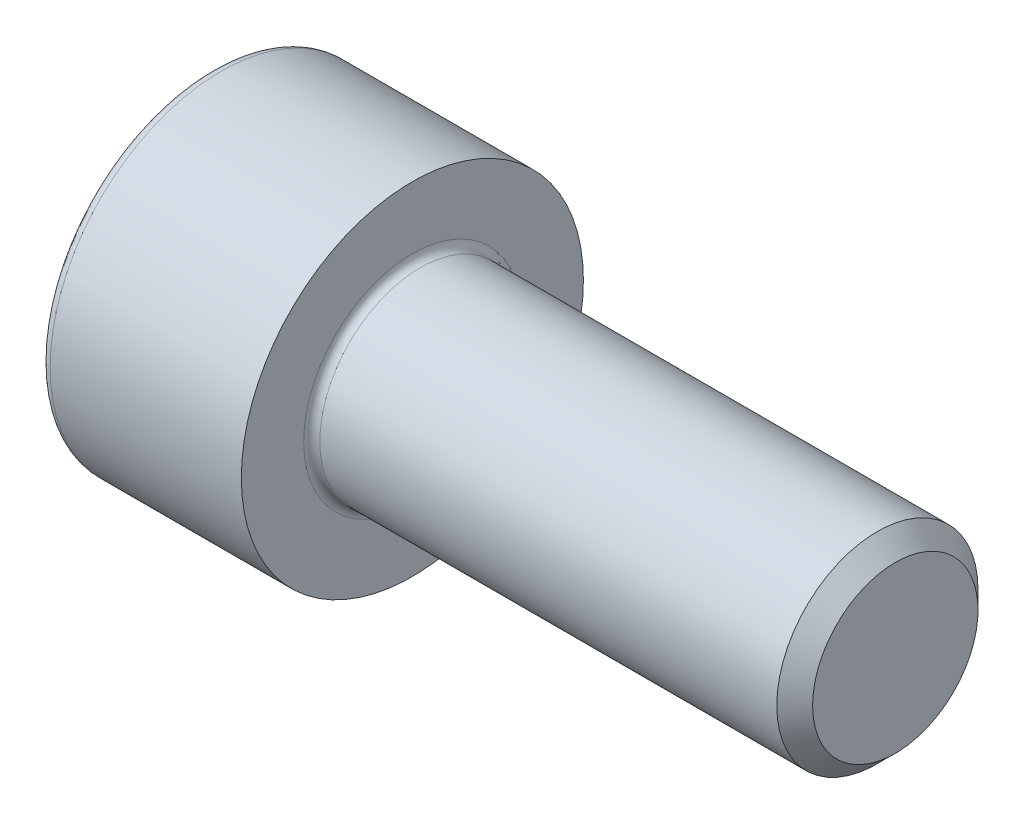
from build123d import *

# Parameters (mm, degrees)
FILLET1_R   = 0.2
FILLET2_R   = 0.25
HEX_2_DEPTH = 2.5


with BuildPart() as part:
    # BodySke → BaseBody (revolve)
    with BuildSketch(Plane.XY, mode=Mode.PRIVATE) as basebody_sk:
        Polygon((0, 0), (0, 4.25), (5, 4.25), (5, 2.5), (16.555, 2.5), (17, 2.055), (17, 0), align=None)
    revolve(basebody_sk.sketch.rotate(Axis((0, 0, 0), (1, 0, 0)), 90), axis=Axis((0, 0, 0), (1, 0, 0)))

    # Fillet1
    fillet1_edges = [part.edges().sort_by_distance(p)[0] for p in [
        (5, 0, -2.5),
    ]]
    fillet(fillet1_edges, radius=FILLET1_R)

    # Fillet2
    fillet2_edges = [part.edges().sort_by_distance(p)[0] for p in [
        (0, 0, -4.25),
    ]]
    fillet(fillet2_edges, radius=FILLET2_R)

    # HexSke → Hex 2 (cut)
    with BuildSketch(Plane(origin=(0, 0, 0), x_dir=(0, 0, -1), z_dir=(1, 0, 0))):
        Polygon((0, 2.309401077), (-2, 1.154700538), (-2, -1.154700538), (0, -2.309401077), (2, -1.154700538), (2, 1.154700538), align=None)
    extrude(amount=HEX_2_DEPTH, mode=Mode.SUBTRACT)

    # Hex-PreBroachSke → Hex-PreBroach (revolve, cut)
    with BuildSketch(Plane.XY, mode=Mode.PRIVATE) as hex_prebroach_sk:
        Polygon((0, 0), (0, 2), (2.5, 2), (3.654700538, 0), align=None)
    revolve(hex_prebroach_sk.sketch.rotate(Axis((0, 0, 0), (1, 0, 0)), 270), axis=Axis((0, 0, 0), (1, 0, 0)), mode=Mode.SUBTRACT)


solid = part.part
